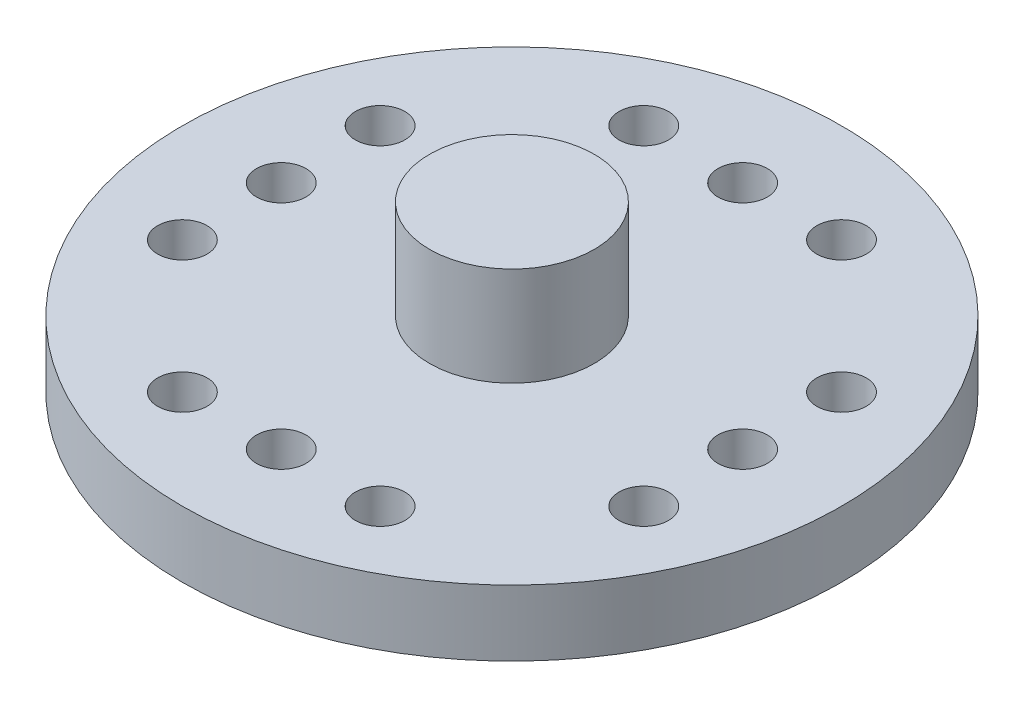
from build123d import *

# Parameters (mm, degrees)
SKETCH_1_R          = 10
EXTRUDE_1_DEPTH     = 2
SKETCH_2_R          = 2.5
EXTRUDE_2_DEPTH     = 3
SKETCH_3_R          = 0.75
CUT_EXTRUDE_1_DEPTH = 15.456832295


with BuildPart() as part:
    # 草图1 → 凸台-拉伸1 (new body)
    with BuildSketch(Plane(origin=(0, 0, 0), x_dir=(1, 0, 0), z_dir=(0, 1, 0))):
        with Locations(Location((0, 0, 0), (0, 0, 270))):
            Circle(SKETCH_1_R)
    extrude(amount=EXTRUDE_1_DEPTH)

    # 草图2 → 凸台-拉伸2 (add)
    with BuildSketch(Plane(origin=(0, 2, 0), x_dir=(1, 0, 0), z_dir=(0, 1, 0))):
        with Locations(Location((0, 0, 0), (0, 0, 270))):
            Circle(SKETCH_2_R)
    extrude(amount=EXTRUDE_2_DEPTH)

    # 草图3 → 切除-拉伸1 (cut, through all)
    with BuildSketch(Plane(origin=(0, 2, 0), x_dir=(1, 0, 0), z_dir=(0, 1, 0))):
        with Locations(Location((0, 7, 0), (0, 0, 270))):
            Circle(SKETCH_3_R)
        with Locations(Location((-3, 7, 0), (0, 0, 270))):
            Circle(SKETCH_3_R)
        with Locations(Location((3, 7, 0), (0, 0, 270))):
            Circle(SKETCH_3_R)
        with Locations(Location((7, 3, 0), (0, 0, 270))):
            Circle(SKETCH_3_R)
        with Locations(Location((7, 0, 0), (0, 0, 270))):
            Circle(SKETCH_3_R)
        with Locations(Location((7, -3, 0), (0, 0, 270))):
            Circle(SKETCH_3_R)
        with Locations(Location((3, -7, 0), (0, 0, 270))):
            Circle(SKETCH_3_R)
        with Locations(Location((0, -7, 0), (0, 0, 270))):
            Circle(SKETCH_3_R)
        with Locations(Location((-3, -7, 0), (0, 0, 270))):
            Circle(SKETCH_3_R)
        with Locations(Location((-7, -3, 0), (0, 0, 270))):
            Circle(SKETCH_3_R)
        with Locations(Location((-7, 0, 0), (0, 0, 270))):
            Circle(SKETCH_3_R)
        with Locations(Location((-7, 3, 0), (0, 0, 270))):
            Circle(SKETCH_3_R)
    extrude(amount=-CUT_EXTRUDE_1_DEPTH, mode=Mode.SUBTRACT)


solid = part.part
